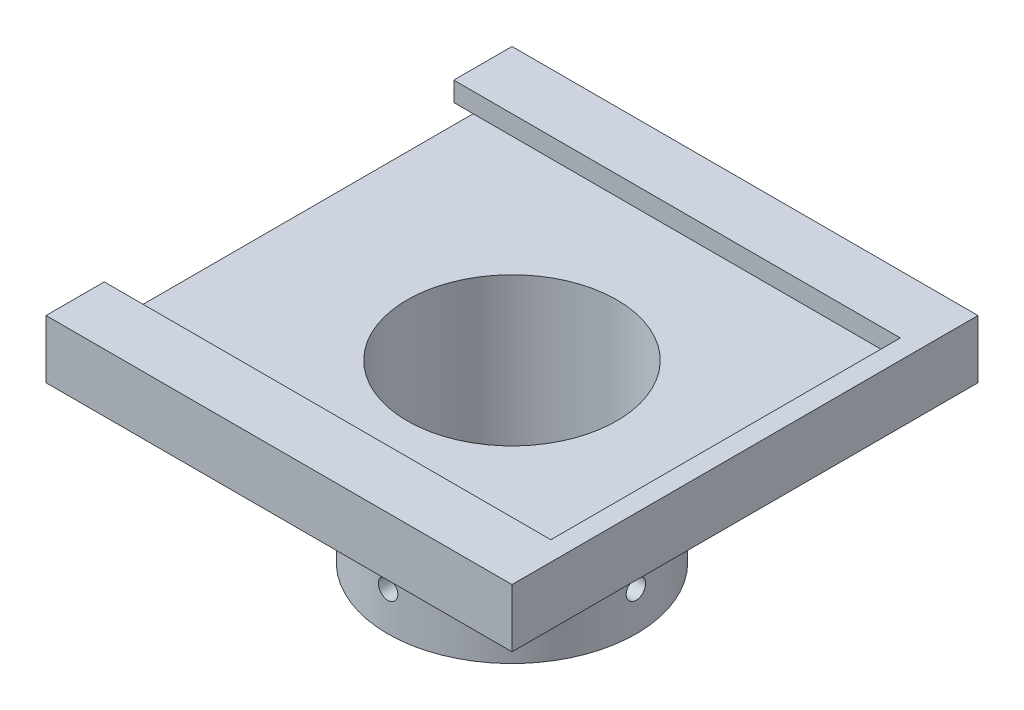
from build123d import *

# Parameters (mm, degrees)
SKETCH1_R           = 20.32
SKETCH1_R_2         = 17.145
BOSS_EXTRUDE1_DEPTH = 25.4
SKETCH2_W           = 76.2
SKETCH2_H           = 76.2
SKETCH2_R           = 17.145
BOSS_EXTRUDE2_DEPTH = 3.175
SKETCH3_W           = 76.2
SKETCH3_H           = 3.175
BOSS_EXTRUDE3_DEPTH = 6.35
BOSS_EXTRUDE4_REACH = 91.465
SKETCH4_W           = 3.175
SKETCH4_H           = 6.35
SKETCH5_W           = 6.35
SKETCH5_H           = 3.175
BOSS_EXTRUDE5_DEPTH = 73.025
SKETCH7_R           = 1.5875
CUT_EXTRUDE1_DEPTH  = 65.210401221
CIRPATTERN1_COUNT   = 4


with BuildPart() as part:
    # Sketch1 → Boss-Extrude1 (new body)
    with BuildSketch(Plane(origin=(0, 0, 0), x_dir=(1, 0, 0), z_dir=(0, 1, 0))):
        with Locations(Location((0, 0, 0), (0, 0, 270))):
            Circle(SKETCH1_R)
        with Locations(Location((0, 0, 0), (0, 0, 270))):
            Circle(SKETCH1_R_2, mode=Mode.SUBTRACT)
    extrude(amount=BOSS_EXTRUDE1_DEPTH)

    # Sketch2 → Boss-Extrude2 (add)
    with BuildSketch(Plane(origin=(0, 25.4, 0), x_dir=(1, 0, 0), z_dir=(0, 1, 0))):
        Rectangle(SKETCH2_W, SKETCH2_H)
        with Locations(Location((0, 0, 0), (0, 0, 270))):
            Circle(SKETCH2_R, mode=Mode.SUBTRACT)
    extrude(amount=BOSS_EXTRUDE2_DEPTH)

    # Sketch3 → Boss-Extrude3 (add)
    with BuildSketch(Plane(origin=(0, 28.575, 0), x_dir=(1, 0, 0), z_dir=(0, 1, 0))):
        with Locations((0, 36.5125)):
            Rectangle(SKETCH3_W, SKETCH3_H)
        with Locations((0, -36.5125)):
            Rectangle(SKETCH3_W, SKETCH3_H)
    extrude(amount=BOSS_EXTRUDE3_DEPTH)

    # Sketch4 → Boss-Extrude4 (add, up to next)
    with BuildSketch(Plane.XY.offset(-34.925), mode=Mode.PRIVATE) as boss_extrude4_sk1:
        with Locations((36.5125, 31.75)):
            Rectangle(SKETCH4_W, SKETCH4_H)
    boss_extrude4_tool1 = extrude(boss_extrude4_sk1.sketch, amount=BOSS_EXTRUDE4_REACH, mode=Mode.PRIVATE) - part.part
    add(boss_extrude4_tool1.solids().sort_by_distance((36.5125, 31.75, -34.925))[0])

    # Sketch5 → Boss-Extrude5 (add)
    with BuildSketch(Plane.ZY.offset(-34.925)):
        with Locations((-31.75, 33.3375)):
            Rectangle(SKETCH5_W, SKETCH5_H)
        with Locations((31.75, 33.3375)):
            Rectangle(SKETCH5_W, SKETCH5_H)
    extrude(amount=BOSS_EXTRUDE5_DEPTH)

    # Sketch7 → Cut-Extrude1 (cut, symmetric)
    with BuildSketch(Plane(origin=(0, 0, 0), x_dir=(0, 0, -1), z_dir=(1, 0, 0))):
        with Locations((0, 6.35)):
            Circle(SKETCH7_R)
    cut_extrude1 = extrude(amount=CUT_EXTRUDE1_DEPTH, both=True, mode=Mode.SUBTRACT)

    # CirPattern1: Cut-Extrude1 ×4 about axis
    cirpattern1_axis = Axis((0, 25.4, 0), (0, -1, 0))
    for i in range(1, CIRPATTERN1_COUNT):
        add(cut_extrude1.rotate(cirpattern1_axis, i * 360 / CIRPATTERN1_COUNT), mode=Mode.SUBTRACT)


solid = part.part
